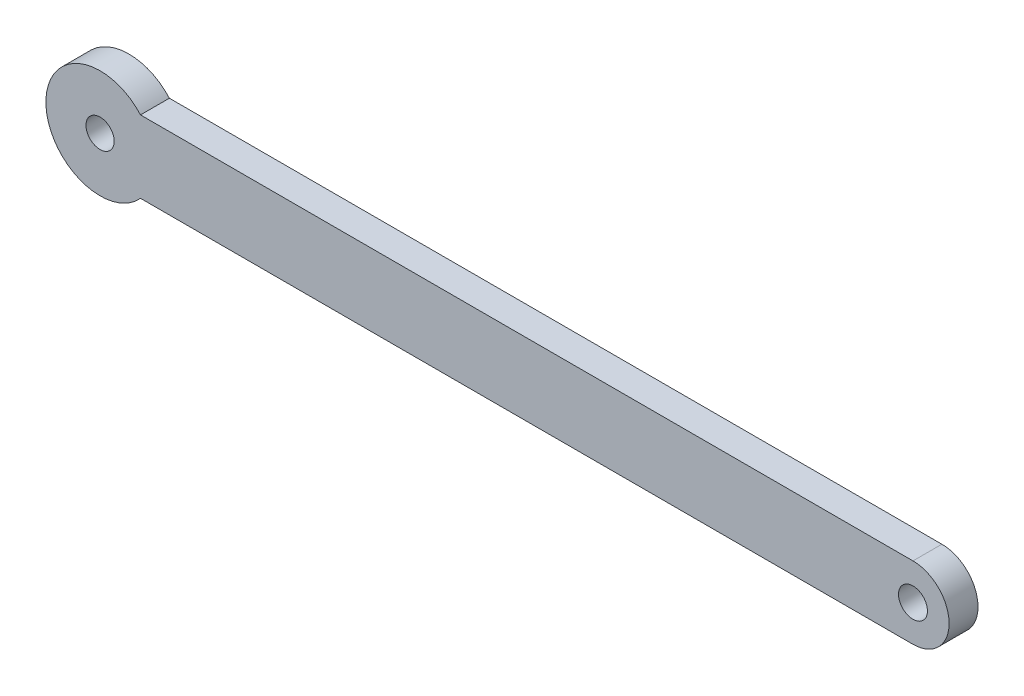
from build123d import *

# Parameters (mm, degrees)
SKETCH_1_R      = 2
SKETCH_1_R_2    = 1.95
EXTRUDE_1_DEPTH = 2


with BuildPart() as part:
    # 草图1 → 凸台-拉伸1 (new, symmetric)
    with BuildSketch(Plane.XY):
        with BuildLine():
            Line((5.590169944, 5), (112.5, 5))
            ThreePointArc((112.5, 5), (117.5, 0), (112.5, -5))
            Line((112.5, -5), (5.590169944, -5))
            ThreePointArc((5.590169944, -5), (-7.5, 0), (5.590169944, 5))
        make_face()
        with Locations((112.5, 0)):
            Circle(SKETCH_1_R, mode=Mode.SUBTRACT)
        Circle(SKETCH_1_R_2, mode=Mode.SUBTRACT)
    extrude(amount=EXTRUDE_1_DEPTH, both=True)


solid = part.part
